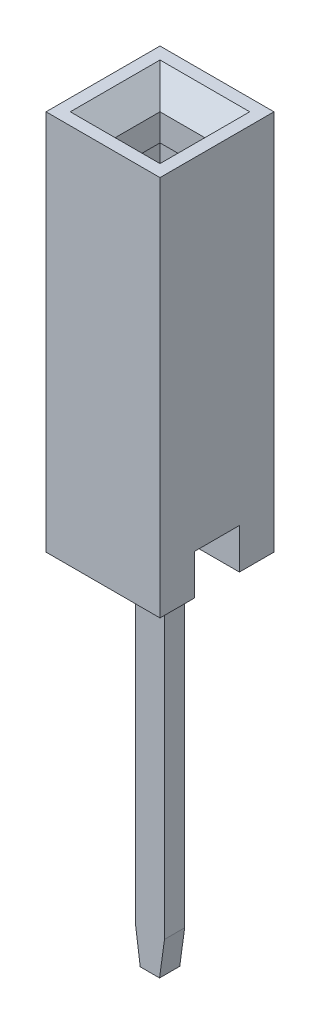
from build123d import *

# Parameters (mm, degrees)
SKETCH1_W               = 2.54
SKETCH1_H               = 2.54
BOSS_EXTRUDE1_DEPTH     = 8.5
SHELL1_T                = -0.77
CHAMFER1_SIZE           = 0.5
CUT_EXTRUDE1_DEPTH      = 9.687680933
CUT_EXTRUDE1_DEPTH_BACK = 9.687680933
SKETCH2_W               = 1
SKETCH2_H               = 0.9
CUT_EXTRUDE3_START      = 1.4
SKETCH3_W               = 2
SKETCH3_H               = 2
CUT_EXTRUDE3_DEPTH      = 6
BOSS_EXTRUDE2_DEPTH     = 0.225


with BuildPart() as part:
    # Sketch1 → Boss-Extrude1 (new body)
    with BuildSketch(Plane(origin=(0, 0, 0), x_dir=(1, 0, 0), z_dir=(0, 1, 0))):
        Rectangle(SKETCH1_W, SKETCH1_H)
    extrude(amount=BOSS_EXTRUDE1_DEPTH)

    # Shell1
    shell1_openings = [part.faces().sort_by_distance(p)[0] for p in [
        (0, 8.5, 0),
    ]]
    offset(amount=SHELL1_T, openings=shell1_openings, kind=Kind.INTERSECTION)

    # Chamfer1
    chamfer1_edges = [part.edges().sort_by_distance(p)[0] for p in [
        (-0.5, 8.5, 0),
        (0, 8.5, 0.5),
        (0.5, 8.5, 0),
        (0, 8.5, -0.5),
    ]]
    chamfer(chamfer1_edges, length=CHAMFER1_SIZE)

    # Sketch2 → Cut-Extrude1 (cut, two sides: drawn at the far end of the back side and taken through both)
    with BuildSketch(Plane(origin=(0, 0, 0), x_dir=(0, 0, -1), z_dir=(1, 0, 0)).offset(-CUT_EXTRUDE1_DEPTH_BACK)):
        with Locations((0, 0.45)):
            Rectangle(SKETCH2_W, SKETCH2_H)
    extrude(amount=CUT_EXTRUDE1_DEPTH + CUT_EXTRUDE1_DEPTH_BACK, mode=Mode.SUBTRACT)

    # Sketch3 → Cut-Extrude3 (cut)
    with BuildSketch(Plane(origin=(0, 0, 0), x_dir=(1, 0, 0), z_dir=(0, 1, 0)).offset(CUT_EXTRUDE3_START)):
        Rectangle(SKETCH3_W, SKETCH3_H)
    extrude(amount=CUT_EXTRUDE3_DEPTH, mode=Mode.SUBTRACT)

    # Sketch4 → Boss-Extrude2 (add, symmetric)
    with BuildSketch(Plane.XY):
        with BuildLine():
            Line((-1, 7.3), (-1, 1.4))
            Line((-1, 1.4), (-0.325, 1.4))
            Line((-0.325, 1.4), (-0.325, -7.2))
            Line((-0.325, -7.2), (-0.215, -8))
            Line((-0.215, -8), (0.215, -8))
            Line((0.215, -8), (0.325, -7.2))
            Line((0.325, -7.2), (0.325, 1.4))
            Line((0.325, 1.4), (1, 1.4))
            Line((1, 1.4), (1, 7.3))
            ThreePointArc((1, 7.3), (0.931110636, 7.382586314), (0.837506501, 7.329628693))
            Line((0.837506501, 7.329628693), (0.6, 6.7))
            ThreePointArc((0.6, 6.7), (0.435896058, 5.8), (0.6, 4.9))
            Line((0.6, 4.9), (0.6, 2.8))
            ThreePointArc((0.6, 2.8), (0, 2.2), (-0.6, 2.8))
            Line((-0.6, 2.8), (-0.6, 4.9))
            ThreePointArc((-0.6, 4.9), (-0.435896058, 5.8), (-0.6, 6.7))
            Line((-0.6, 6.7), (-0.837506501, 7.329628693))
            ThreePointArc((-0.837506501, 7.329628693), (-0.931110636, 7.382586314), (-1, 7.3))
        make_face()
    extrude(amount=BOSS_EXTRUDE2_DEPTH, both=True)


solid = part.part
